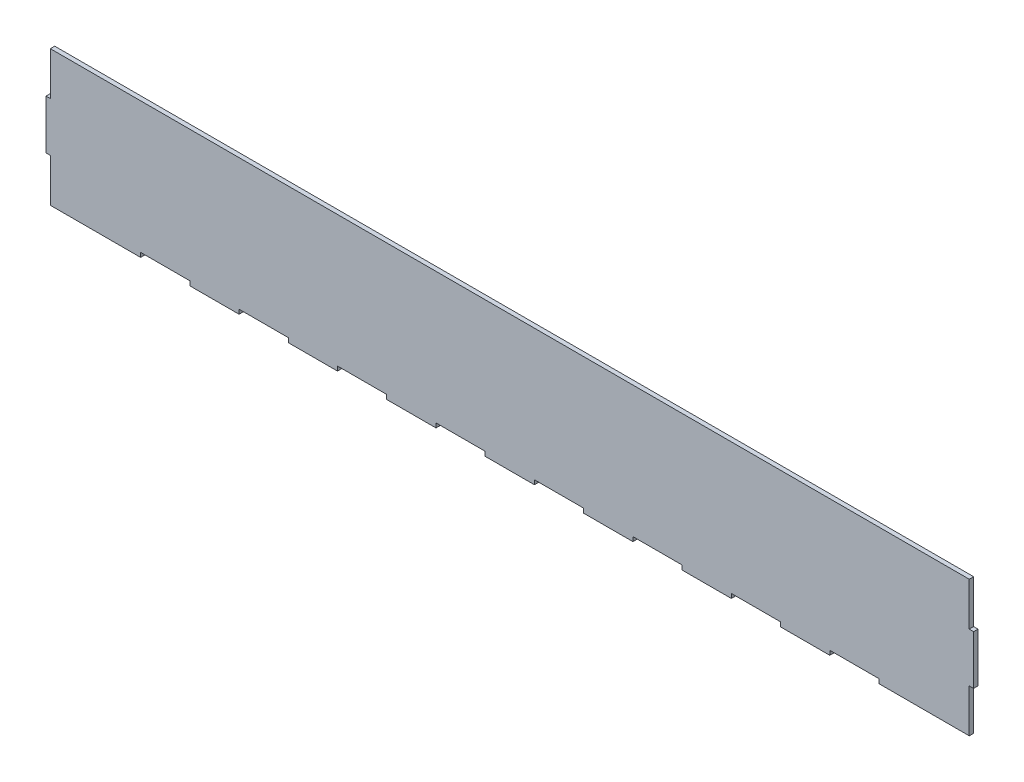
from build123d import *

# Parameters (mm, degrees)
BOSS_EXTRUDE1_DEPTH = 3


with BuildPart() as part:
    # Model → Boss-Extrude1 (new body)
    with BuildSketch(Plane.XY):
        Polygon((642, 96), (642, 66.375), (639, 66.375), (639, 32.625), (642, 32.625), (642, 3), (703.875, 3), (703.875, 6), (737.625, 6), (737.625, 3), (771.375, 3), (771.375, 6), (805.125, 6), (805.125, 3), (838.875, 3), (838.875, 6), (872.625, 6), (872.625, 3), (906.375, 3), (906.375, 6), (940.125, 6), (940.125, 3), (973.875, 3), (973.875, 6), (1007.625, 6), (1007.625, 3), (1041.375, 3), (1041.375, 6), (1075.125, 6), (1075.125, 3), (1108.875, 3), (1108.875, 6), (1142.625, 6), (1142.625, 3), (1176.375, 3), (1176.375, 6), (1210.125, 6), (1210.125, 3), (1243.875, 3), (1272, 3), (1272, 32.625), (1275, 32.625), (1275, 66.375), (1272, 66.375), (1272, 96), align=None)
    extrude(amount=BOSS_EXTRUDE1_DEPTH)


solid = part.part
